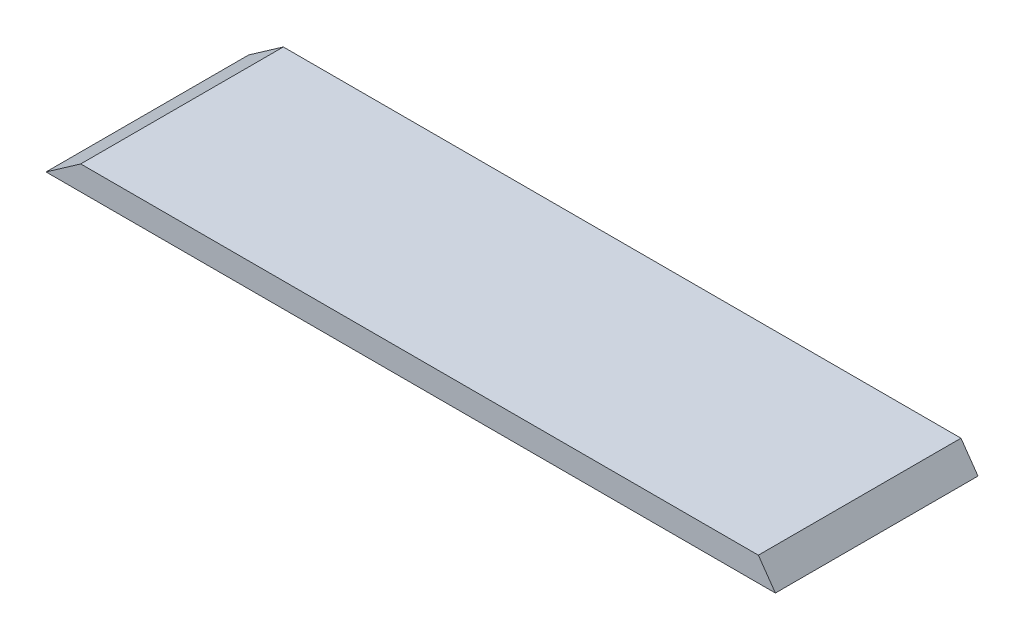
from build123d import *

# Parameters (mm, degrees)
EXTRUDE_1_DEPTH = 25


with BuildPart() as part:
    # Эскиз2 → Бобышка-Вытянуть1 (new body)
    with BuildSketch(Plane.XY):
        Polygon((-45, 0), (45, 0), (42.899377385, 3), (-40.71555598, 3), align=None)
    extrude(amount=EXTRUDE_1_DEPTH)


solid = part.part
